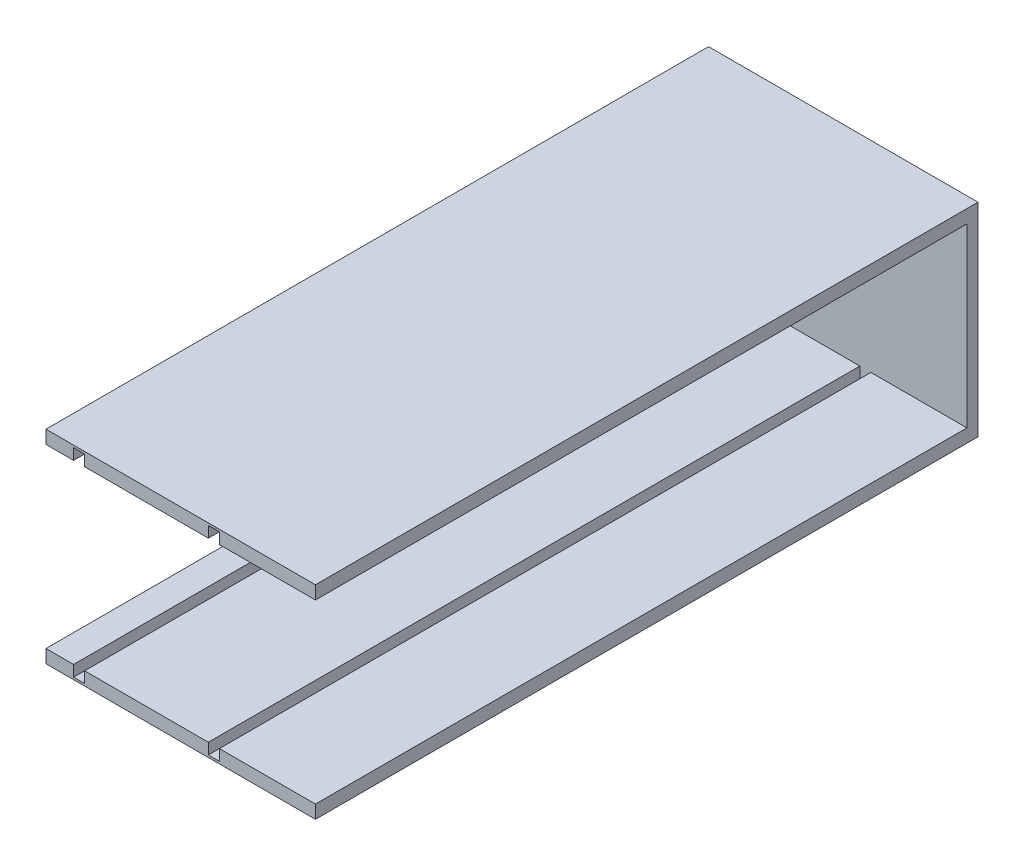
from build123d import *

# Parameters (mm, degrees)
BOSS_EXTRUDE1_DEPTH   = 1500
BOSS_EXTRUDE1_2_DEPTH = 1500
SKETCH5_W             = 610
SKETCH5_H             = 460
BOSS_EXTRUDE5_DEPTH   = 25


with BuildPart() as part:
    # Sketch1 → Boss-Extrude1 (new body)
    with BuildSketch(Plane.XY):
        Polygon((0, -30), (217.5, -30), (217.5, -5), (242.5, -5), (242.5, -30), (460, -30), (460, 0), (0, 0), (-150, 0), (-150, -30), (-87.5, -30), (-87.5, -5), (-62.5, -5), (-62.5, -30), align=None)
    extrude(amount=BOSS_EXTRUDE1_DEPTH)



with BuildPart() as body_2:
    # Sketch1 → Boss-Extrude1 2 (new body)
    with BuildSketch(Plane.XY):
        Polygon((-62.5, -430), (0, -430), (217.5, -430), (217.5, -455), (242.5, -455), (242.5, -430), (460, -430), (460, -460), (0, -460), (-150, -460), (-150, -430), (-87.5, -430), (-87.5, -455), (-62.5, -455), align=None)
    extrude(amount=BOSS_EXTRUDE1_2_DEPTH)


with BuildPart() as part_1:
    add(part.part)

    add(body_2.part)  # Boss-Extrude5 merges body 2
    # Sketch5 → Boss-Extrude5 (add)
    with BuildSketch(Plane(origin=(0, 0, 0), x_dir=(-1, 0, 0), z_dir=(0, 0, -1))):
        with Locations((-155, -230)):
            Rectangle(SKETCH5_W, SKETCH5_H)
    extrude(amount=-BOSS_EXTRUDE5_DEPTH)


solid = part_1.part
